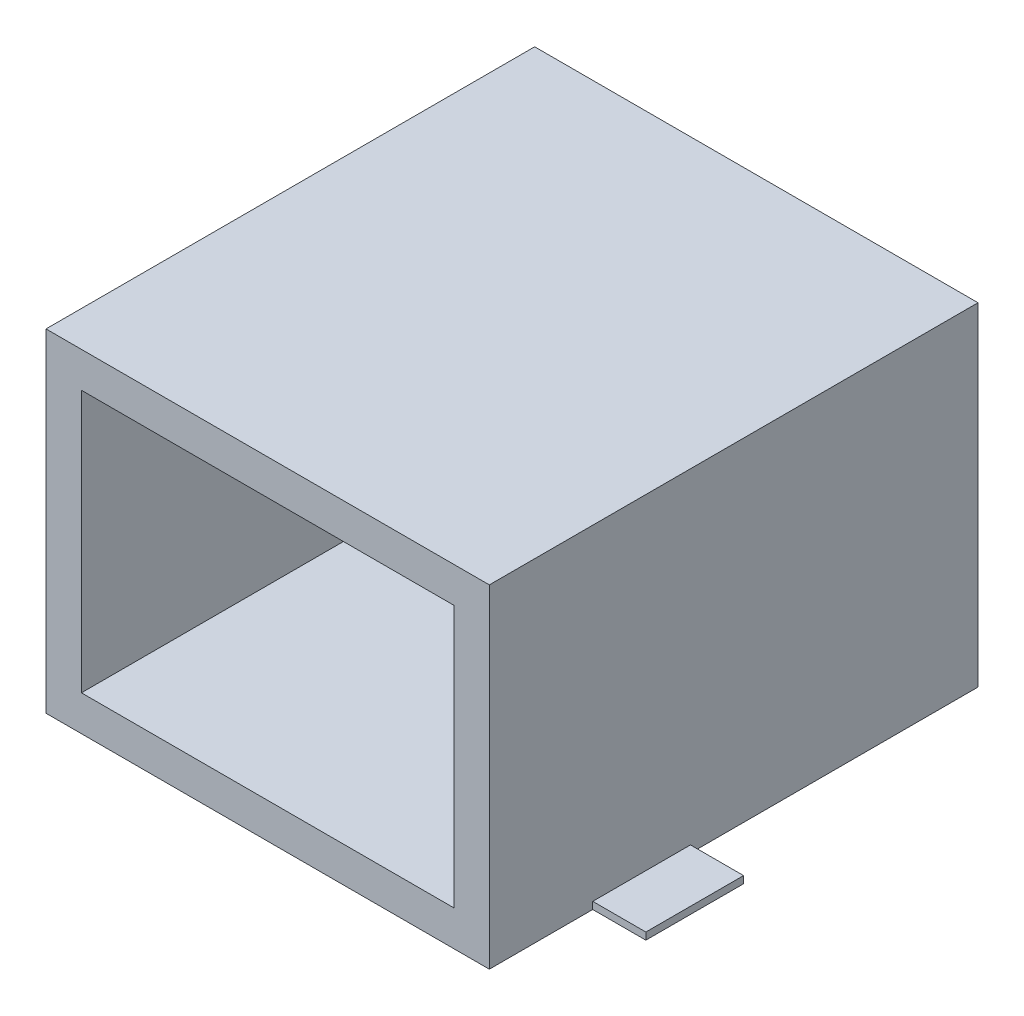
from build123d import *

# Parameters (mm, degrees)
SKETCH1_W           = 15.9004
SKETCH1_H           = 11.938
BOSS_EXTRUDE1_DEPTH = 17.526
SHELL1_T            = -1.27
SKETCH2_W           = 1.905
SKETCH2_H           = 3.5052
BOSS_EXTRUDE2_DEPTH = 0.254


with BuildPart() as part:
    # Sketch1 → Boss-Extrude1 (new body)
    with BuildSketch(Plane.XY):
        Rectangle(SKETCH1_W, SKETCH1_H)
    extrude(amount=-BOSS_EXTRUDE1_DEPTH)

    # Shell1
    shell1_openings = [part.faces().sort_by_distance(p)[0] for p in [
        (0, 0, 0),
    ]]
    offset(amount=SHELL1_T, openings=shell1_openings, kind=Kind.INTERSECTION)

    # Sketch2 → Boss-Extrude2 (add)
    with BuildSketch(Plane.XZ.offset(5.969)):
        with Locations((-8.9027, -5.461)):
            Rectangle(SKETCH2_W, SKETCH2_H)
    boss_extrude2 = extrude(amount=-BOSS_EXTRUDE2_DEPTH)

    # Mirror1: Boss-Extrude2 across plane
    add(boss_extrude2.mirror(Plane(origin=(0, 0, 0), x_dir=(0, 0, 1), z_dir=(1, 0, 0))))


solid = part.part
